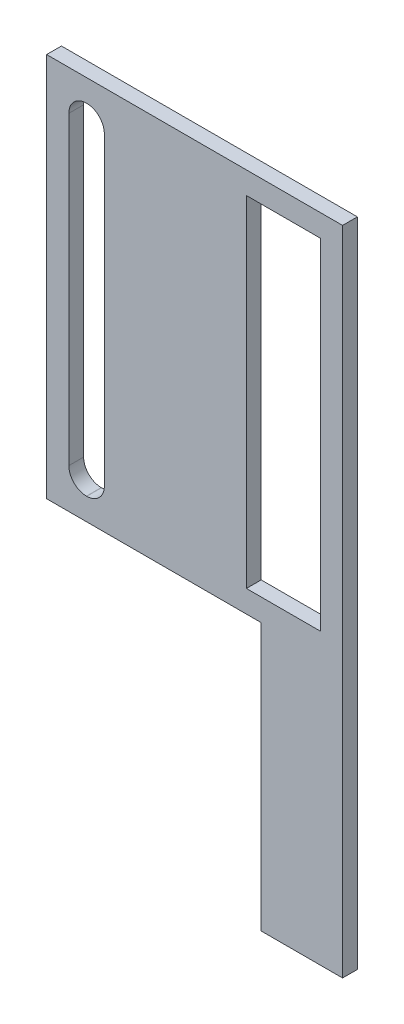
from build123d import *

# Parameters (mm, degrees)
SKETCH1_W           = 5.5
SKETCH1_H           = 39.3
BOSS_EXTRUDE1_DEPTH = 1
SKETCH3_W           = 20
SKETCH3_H           = 26
BOSS_EXTRUDE5_DEPTH = 1
CUT_EXTRUDE3_DEPTH  = 1
SKETCH5_W           = 5
SKETCH5_H           = 23
CUT_EXTRUDE4_DEPTH  = 1


with BuildPart() as part:
    # Sketch1 → Boss-Extrude1 (new body)
    with BuildSketch(Plane.XY):
        Rectangle(SKETCH1_W, SKETCH1_H)
    extrude(amount=BOSS_EXTRUDE1_DEPTH)

    # Sketch3 → Boss-Extrude5 (add)
    with BuildSketch(Plane.XY.offset(1)):
        with Locations((-7.25, 11.4)):
            Rectangle(SKETCH3_W, SKETCH3_H)
    extrude(amount=-BOSS_EXTRUDE5_DEPTH)

    # Sketch4 → Cut-Extrude3 (cut)
    with BuildSketch(Plane.XY.offset(1)):
        with BuildLine():
            Line((-14.56, 22.9), (-14.54, 22.9))
            ThreePointArc((-14.54, 22.9), (-13.69854293, 22.55145707), (-13.35, 21.71))
            Line((-13.35, 21.71), (-13.35, 1.09))
            ThreePointArc((-13.35, 1.09), (-13.69854293, 0.24854293), (-14.54, -0.1))
            Line((-14.54, -0.1), (-14.56, -0.1))
            ThreePointArc((-14.56, -0.1), (-15.40145707, 0.24854293), (-15.75, 1.09))
            Line((-15.75, 1.09), (-15.75, 21.71))
            ThreePointArc((-15.75, 21.71), (-15.40145707, 22.55145707), (-14.56, 22.9))
        make_face()
    extrude(amount=-CUT_EXTRUDE3_DEPTH, mode=Mode.SUBTRACT)

    # Sketch5 → Cut-Extrude4 (cut)
    with BuildSketch(Plane.XY.offset(1)):
        with Locations((-1.25, 11.4)):
            Rectangle(SKETCH5_W, SKETCH5_H)
    extrude(amount=-CUT_EXTRUDE4_DEPTH, mode=Mode.SUBTRACT)


solid = part.part
